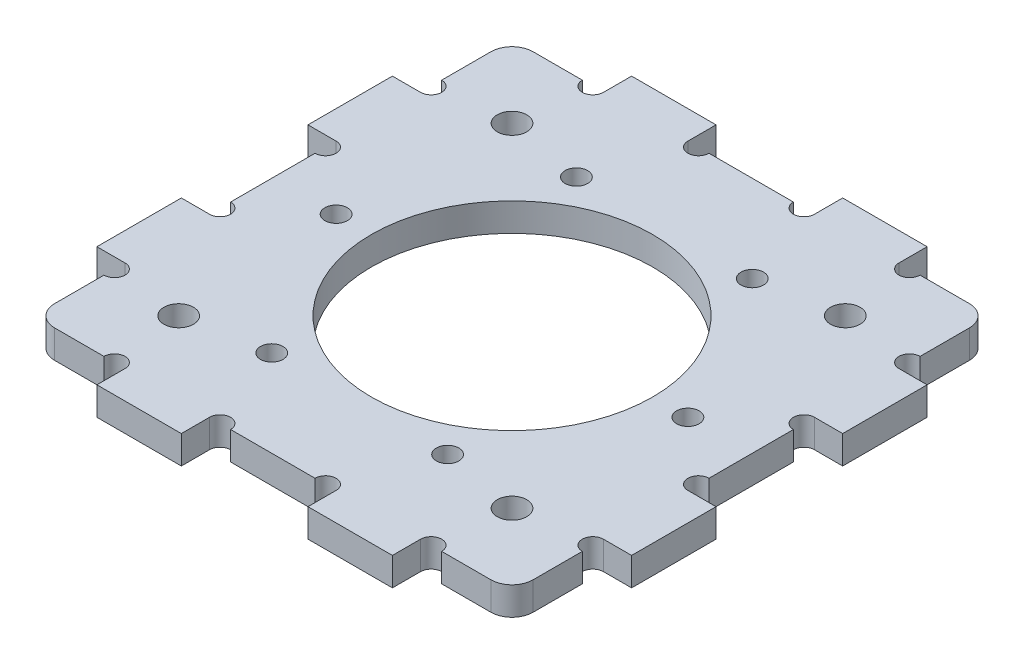
from build123d import *

# Parameters (mm, degrees)
SKETCH_1_W          = 68
SKETCH_1_H          = 68
SKETCH_1_R          = 20
EXTRUDE_1_DEPTH     = 4
SKETCH_2_W          = 12
SKETCH_2_H          = 4
SKETCH_2_W_2        = 4
SKETCH_2_H_2        = 12
EXTRUDE_2_DEPTH     = 4
SKETCH_3_R          = 1.5
CUT_EXTRUDE_1_DEPTH = 4
FILLET_1_R          = 3
SKETCH_4_R          = 1.6
CUT_EXTRUDE_2_DEPTH = 10
SKETCH_5_R          = 2.1
CUT_EXTRUDE_3_DEPTH = 5


with BuildPart() as part:
    # 草图1 → 凸台-拉伸1 (new body)
    with BuildSketch(Plane(origin=(0, 0, 0), x_dir=(1, 0, 0), z_dir=(0, 1, 0))):
        Rectangle(SKETCH_1_W, SKETCH_1_H)
        with Locations(Location((0, 0, 0), (0, 0, 270))):
            Circle(SKETCH_1_R, mode=Mode.SUBTRACT)
    extrude(amount=EXTRUDE_1_DEPTH)

    # 草图2 → 凸台-拉伸2 (add)
    with BuildSketch(Plane(origin=(0, 4, 0), x_dir=(1, 0, 0), z_dir=(0, 1, 0))):
        with Locations((-15, 36)):
            Rectangle(SKETCH_2_W, SKETCH_2_H)
        with Locations((15, 36)):
            Rectangle(SKETCH_2_W, SKETCH_2_H)
        with Locations((36, 15)):
            Rectangle(SKETCH_2_W_2, SKETCH_2_H_2)
        with Locations((36, -15)):
            Rectangle(SKETCH_2_W_2, SKETCH_2_H_2)
        with Locations((15, -36)):
            Rectangle(SKETCH_2_W, SKETCH_2_H)
        with Locations((-15, -36)):
            Rectangle(SKETCH_2_W, SKETCH_2_H)
        with Locations((-36, -15)):
            Rectangle(SKETCH_2_W_2, SKETCH_2_H_2)
        with Locations((-36, 15)):
            Rectangle(SKETCH_2_W_2, SKETCH_2_H_2)
    extrude(amount=-EXTRUDE_2_DEPTH)

    # 草图3 → 切除-拉伸1 (cut)
    with BuildSketch(Plane(origin=(0, 4, 0), x_dir=(1, 0, 0), z_dir=(0, 1, 0))):
        with Locations((-22.5, 34)):
            Circle(SKETCH_3_R)
        with Locations((-7.5, 34)):
            Circle(SKETCH_3_R)
        with Locations((7.5, 34)):
            Circle(SKETCH_3_R)
        with Locations((22.5, 34)):
            Circle(SKETCH_3_R)
        with Locations((34, 22.5)):
            Circle(SKETCH_3_R)
        with Locations((34, 7.5)):
            Circle(SKETCH_3_R)
        with Locations((34, -7.5)):
            Circle(SKETCH_3_R)
        with Locations((34, -22.5)):
            Circle(SKETCH_3_R)
        with Locations((22.5, -34)):
            Circle(SKETCH_3_R)
        with Locations((7.5, -34)):
            Circle(SKETCH_3_R)
        with Locations((-7.5, -34)):
            Circle(SKETCH_3_R)
        with Locations((-22.5, -34)):
            Circle(SKETCH_3_R)
        with Locations((-34, -22.5)):
            Circle(SKETCH_3_R)
        with Locations((-34, -7.5)):
            Circle(SKETCH_3_R)
        with Locations((-34, 7.5)):
            Circle(SKETCH_3_R)
        with Locations((-34, 22.5)):
            Circle(SKETCH_3_R)
    extrude(amount=-CUT_EXTRUDE_1_DEPTH, mode=Mode.SUBTRACT)

    # 圆角1
    fillet_1_edges = [part.edges().sort_by_distance(p)[0] for p in [
        (34, 2, 34),
        (-34, 2, 34),
        (-34, 2, -34),
        (34, 2, -34),
    ]]
    fillet(fillet_1_edges, radius=FILLET_1_R)

    # 草图4 → 切除-拉伸2 (cut)
    with BuildSketch(Plane(origin=(0, 4, 0), x_dir=(1, 0, 0), z_dir=(0, 1, 0))):
        with Locations(Location((25, 0, 0), (0, 0, 270))):
            Circle(SKETCH_4_R)
        with Locations(Location((12.5, -21.650635095, 0), (0, 0, 270))):
            Circle(SKETCH_4_R)
        with Locations(Location((-12.5, -21.650635095, 0), (0, 0, 270))):
            Circle(SKETCH_4_R)
        with Locations(Location((-25, 0, 0), (0, 0, 270))):
            Circle(SKETCH_4_R)
        with Locations(Location((-12.5, 21.650635095, 0), (0, 0, 270))):
            Circle(SKETCH_4_R)
        with Locations(Location((12.5, 21.650635095, 0), (0, 0, 270))):
            Circle(SKETCH_4_R)
    extrude(amount=-CUT_EXTRUDE_2_DEPTH, mode=Mode.SUBTRACT)

    # 草图5 → 切除-拉伸3 (cut)
    with BuildSketch(Plane(origin=(0, 4, 0), x_dir=(1, 0, 0), z_dir=(0, 1, 0))):
        with Locations(Location((23.68807717, 23.68807717, 0), (0, 0, 270))):
            Circle(SKETCH_5_R)
        with Locations(Location((23.68807717, -23.68807717, 0), (0, 0, 270))):
            Circle(SKETCH_5_R)
        with Locations(Location((-23.68807717, -23.68807717, 0), (0, 0, 270))):
            Circle(SKETCH_5_R)
        with Locations(Location((-23.68807717, 23.68807717, 0), (0, 0, 270))):
            Circle(SKETCH_5_R)
    extrude(amount=-CUT_EXTRUDE_3_DEPTH, mode=Mode.SUBTRACT)


solid = part.part
